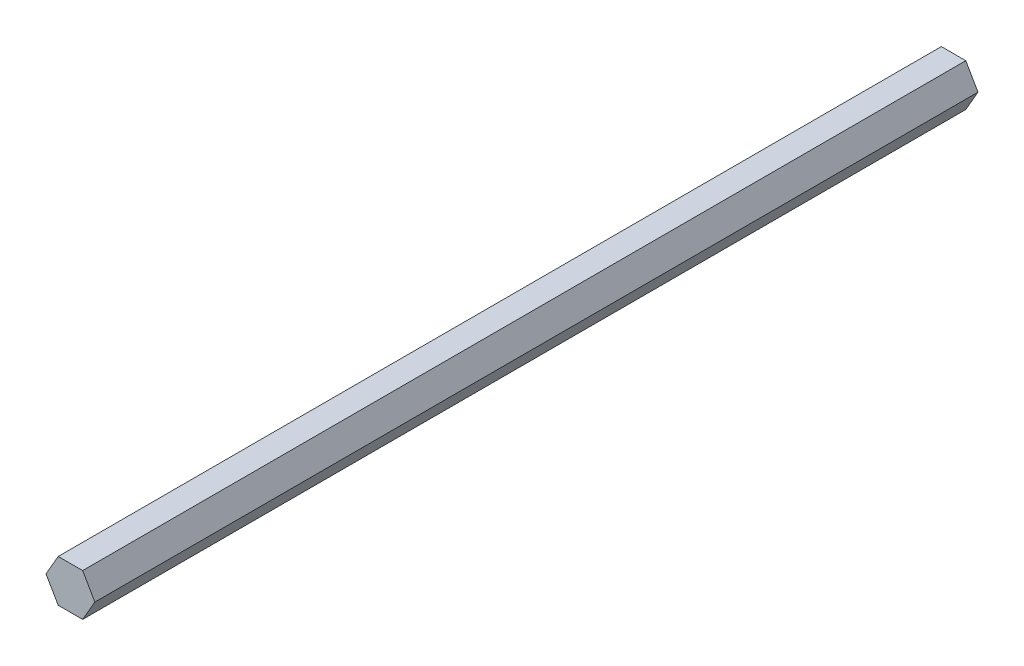
from build123d import *

# Parameters (mm, degrees)
BOSS_EXTRUDE1_DEPTH = 132.5


with BuildPart() as part:
    # Sketch1 → Boss-Extrude1 (new, symmetric)
    with BuildSketch(Plane.XY):
        Polygon((7.332348419, 0), (3.666174209, 6.35), (-3.666174209, 6.35), (-7.332348419, 0), (-3.666174209, -6.35), (3.666174209, -6.35), align=None)
    extrude(amount=BOSS_EXTRUDE1_DEPTH, both=True)


solid = part.part
